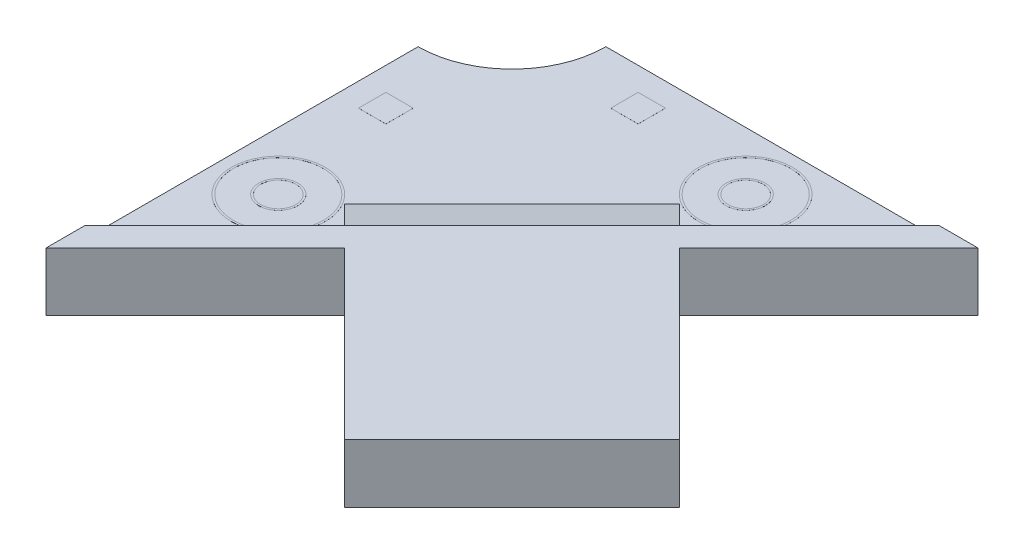
from build123d import *

# Parameters (mm, degrees)
BOSS_EXTRUDE1_DEPTH = 152.4
CUT_EXTRUDE1_DEPTH  = 152.4
BOSS_EXTRUDE2_DEPTH = 38.1
BOSS_EXTRUDE3_DEPTH = 190.5
BOSS_EXTRUDE4_DEPTH = 768.35
SKETCH9_R           = 152.4
SKETCH9_R_2         = 146.05
SKETCH9_R_3         = 63.5
SKETCH9_R_4         = 57.15
SKETCH9_W           = 88.9
SKETCH9_H           = 88.9
BOSS_EXTRUDE5_DEPTH = 0.127


with BuildPart() as part:
    # Sketch2 → Boss-Extrude1 (new body)
    with BuildSketch(Plane(origin=(0, 0, 0), x_dir=(1, 0, 0), z_dir=(0, 1, 0))):
        Polygon((0, 0), (0, -1513.1731564), (1513.1731564, 0), align=None)
    extrude(amount=BOSS_EXTRUDE1_DEPTH)

    # Sketch3 → Cut-Extrude1 (cut)
    with BuildSketch(Plane(origin=(0, 152.4, 0), x_dir=(1, 0, 0), z_dir=(0, 1, 0))):
        with BuildLine():
            Line((0, 0), (304.8, 0))
            ThreePointArc((304.8, 0), (215.526146906, -215.526146906), (0, -304.8))
            Line((0, -304.8), (0, 0))
        make_face()
    extrude(amount=-CUT_EXTRUDE1_DEPTH, mode=Mode.SUBTRACT)

    # Sketch4 → Boss-Extrude2 (add)
    with BuildSketch(Plane(origin=(0, 152.4, 0), x_dir=(1, 0, 0), z_dir=(0, 1, 0))):
        Polygon((0, -1513.1731564), (1513.1731564, 0), (1387.449570705, 0), (0, -1387.449570705), align=None)
    extrude(amount=BOSS_EXTRUDE2_DEPTH)

    # Sketch5 → Boss-Extrude3 (add)
    with BuildSketch(Plane(origin=(0, 0, 0), x_dir=(1, 0, 0), z_dir=(0, 1, 0))):
        Polygon((1028.239325862, -484.933830538), (484.933830538, -1028.239325862), (1023.749197802, -1567.054693127), (1567.054693127, -1023.749197802), align=None)
    extrude(amount=BOSS_EXTRUDE3_DEPTH)

    # Sketch6 → Boss-Extrude4 (add)
    with BuildSketch(Plane(origin=(-271.652747662, 0, 271.652747662), x_dir=(0.7071067811865476, 0, 0.7071067811865476), z_dir=(-0.7071067811865476, 0, 0.7071067811865476))):
        Polygon((981.075, 190.5), (841.375, 152.4), (981.075, 152.4), align=None)
    extrude(amount=-BOSS_EXTRUDE4_DEPTH)

    # Sketch9 → Boss-Extrude5 (add)
    # profile 1 of 6: a face of its own
    with BuildSketch(Plane(origin=(0, 152.4, 0), x_dir=(1, 0, 0), z_dir=(0, 1, 0))):
        with Locations(Location((947.417020773, -188.585378542, 0), (0, 0, 270))):
            Circle(SKETCH9_R)
        with Locations(Location((947.417020773, -188.585378542, 0), (0, 0, 270))):
            Circle(SKETCH9_R_2, mode=Mode.SUBTRACT)
    # profile 2 of 6: a face of its own
    with BuildSketch(Plane(origin=(0, 152.4, 0), x_dir=(1, 0, 0), z_dir=(0, 1, 0))):
        with Locations(Location((947.417020773, -188.585378542, 0), (0, 0, 270))):
            Circle(SKETCH9_R_3)
        with Locations(Location((947.417020773, -188.585378542, 0), (0, 0, 270))):
            Circle(SKETCH9_R_4, mode=Mode.SUBTRACT)
    # profile 3 of 6: a face of its own
    with BuildSketch(Plane(origin=(0, 152.4, 0), x_dir=(1, 0, 0), z_dir=(0, 1, 0))):
        with Locations(Location((188.585378542, -947.417020773, 0), (0, 0, 270))):
            Circle(SKETCH9_R)
        with Locations(Location((188.585378542, -947.417020773, 0), (0, 0, 270))):
            Circle(SKETCH9_R_2, mode=Mode.SUBTRACT)
    # profile 4 of 6: a face of its own
    with BuildSketch(Plane(origin=(0, 152.4, 0), x_dir=(1, 0, 0), z_dir=(0, 1, 0))):
        with Locations(Location((188.585378542, -947.417020773, 0), (0, 0, 270))):
            Circle(SKETCH9_R_3)
        with Locations(Location((188.585378542, -947.417020773, 0), (0, 0, 270))):
            Circle(SKETCH9_R_4, mode=Mode.SUBTRACT)
    # profile 5 of 6: a face of its own
    with BuildSketch(Plane(origin=(0, 152.4, 0), x_dir=(1, 0, 0), z_dir=(0, 1, 0))):
        with Locations((530.199570705, -120.65)):
            Rectangle(SKETCH9_W, SKETCH9_H)
    # profile 6 of 6: a face of its own
    with BuildSketch(Plane(origin=(0, 152.4, 0), x_dir=(1, 0, 0), z_dir=(0, 1, 0))):
        with Locations((120.65, -530.199570705)):
            Rectangle(SKETCH9_W, SKETCH9_H)
    extrude(amount=BOSS_EXTRUDE5_DEPTH)


solid = part.part
